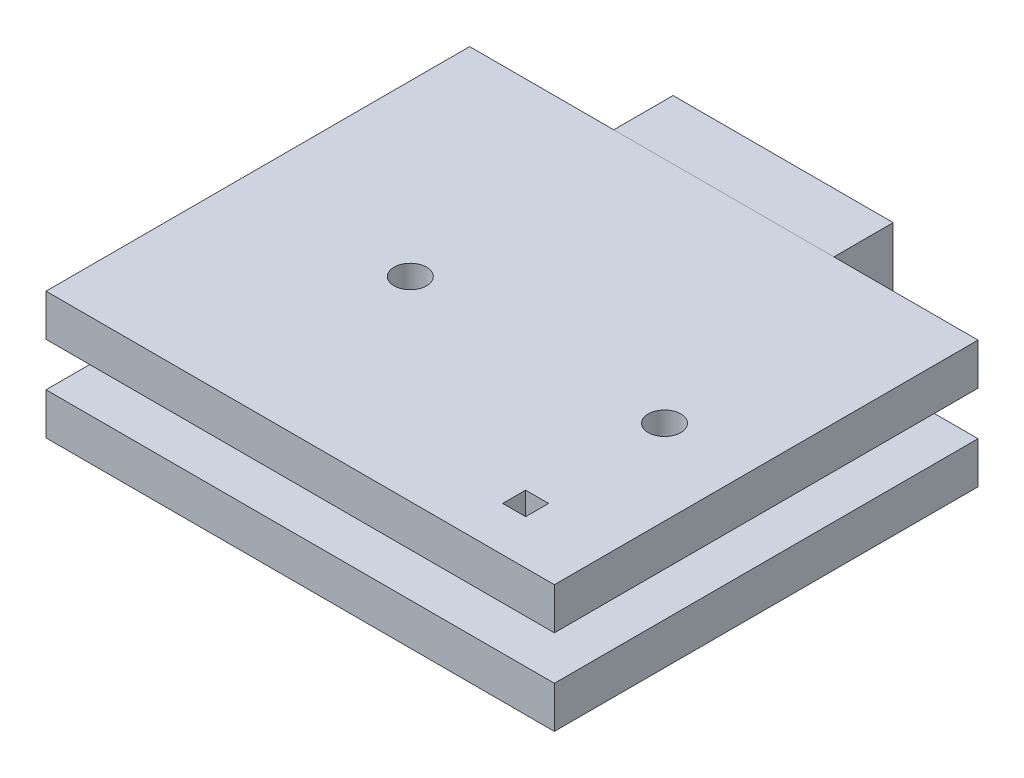
from build123d import *

# Parameters (mm, degrees)
SKETCH1_W               = 76.2
SKETCH1_H               = 19.05
BOSS_EXTRUDE1_DEPTH     = 63.5
SKETCH2_W               = 76.2
SKETCH2_H               = 6.550000108
CUT_EXTRUDE1_DEPTH      = 69.85
SKETCH4_W               = 32.995567884
SKETCH4_H               = 19.05
BOSS_EXTRUDE2_DEPTH     = 8.89
SKETCH6_W               = 20.32
SKETCH6_H               = 6.550000108
CUT_EXTRUDE4_DEPTH      = 12.7
CUT_EXTRUDE5_DEPTH      = 77.464125575
CUT_EXTRUDE5_DEPTH_BACK = 77.464125575
SKETCH3_R               = 2.434895054
SKETCH3_W               = 3.443461608
SKETCH3_H               = 3.443461609


with BuildPart() as part:
    # Sketch1 → Boss-Extrude1 (new body)
    with BuildSketch(Plane.XY):
        Rectangle(SKETCH1_W, SKETCH1_H)
    extrude(amount=BOSS_EXTRUDE1_DEPTH)

    # Sketch2 → Cut-Extrude1 (cut)
    with BuildSketch(Plane(origin=(0, 0, 0), x_dir=(-1, 0, 0), z_dir=(0, 0, -1))):
        Rectangle(SKETCH2_W, SKETCH2_H)
    extrude(amount=-CUT_EXTRUDE1_DEPTH, mode=Mode.SUBTRACT)


with BuildPart() as cut_extrude1_piece_1:
    # of the separate pieces the step leaves, piece 1, a body of its own (cut_extrude1_pieces)
    add(part.part.solids().sort_by_distance((-38.1, 9.525, 0))[0])


with BuildPart() as cut_extrude1_piece_2:
    # of the separate pieces the step leaves, piece 2, a body of its own (cut_extrude1_pieces)
    add(part.part.solids().sort_by_distance((-38.1, -9.525, 0))[0])

    # Sketch4 → Boss-Extrude2 (add)
    with BuildSketch(Plane(origin=(0, 0, 0), x_dir=(-1, 0, 0), z_dir=(0, 0, -1))):
        Rectangle(SKETCH4_W, SKETCH4_H)
    extrude(amount=BOSS_EXTRUDE2_DEPTH)

    # Sketch6 → Cut-Extrude4 (cut)
    with BuildSketch(Plane(origin=(0, 0, -8.89), x_dir=(-1, 0, 0), z_dir=(0, 0, -1))):
        Rectangle(SKETCH6_W, SKETCH6_H)
    extrude(amount=-CUT_EXTRUDE4_DEPTH, mode=Mode.SUBTRACT)


with BuildPart() as cut_extrude5_tool:
    # Sketch3 → Cut-Extrude5 (new, two sides: drawn at the far end of the back side and taken through both)
    with BuildSketch(Plane.XZ.offset(9.525).offset(-CUT_EXTRUDE5_DEPTH_BACK)):
        with Locations(Location((25.4, 34.29, 0), (0, 0, 270))):
            Circle(SKETCH3_R)
        with Locations(Location((-12.7, 34.29, 0), (0, 0, 270))):
            Circle(SKETCH3_R)
        with Locations((25.4, 55.107720771)):
            Rectangle(SKETCH3_W, SKETCH3_H)
    extrude(amount=CUT_EXTRUDE5_DEPTH + CUT_EXTRUDE5_DEPTH_BACK)


with BuildPart() as cut_extrude1_piece_1_1:
    add(cut_extrude1_piece_1.part)

    # Cut-Extrude5: cut by cut_extrude5_tool
    add(cut_extrude5_tool.part, mode=Mode.SUBTRACT)


with BuildPart() as cut_extrude1_piece_2_1:
    add(cut_extrude1_piece_2.part)

    # Cut-Extrude5: cut by cut_extrude5_tool
    add(cut_extrude5_tool.part, mode=Mode.SUBTRACT)


solid = Compound([cut_extrude1_piece_1_1.part, cut_extrude1_piece_2_1.part])
